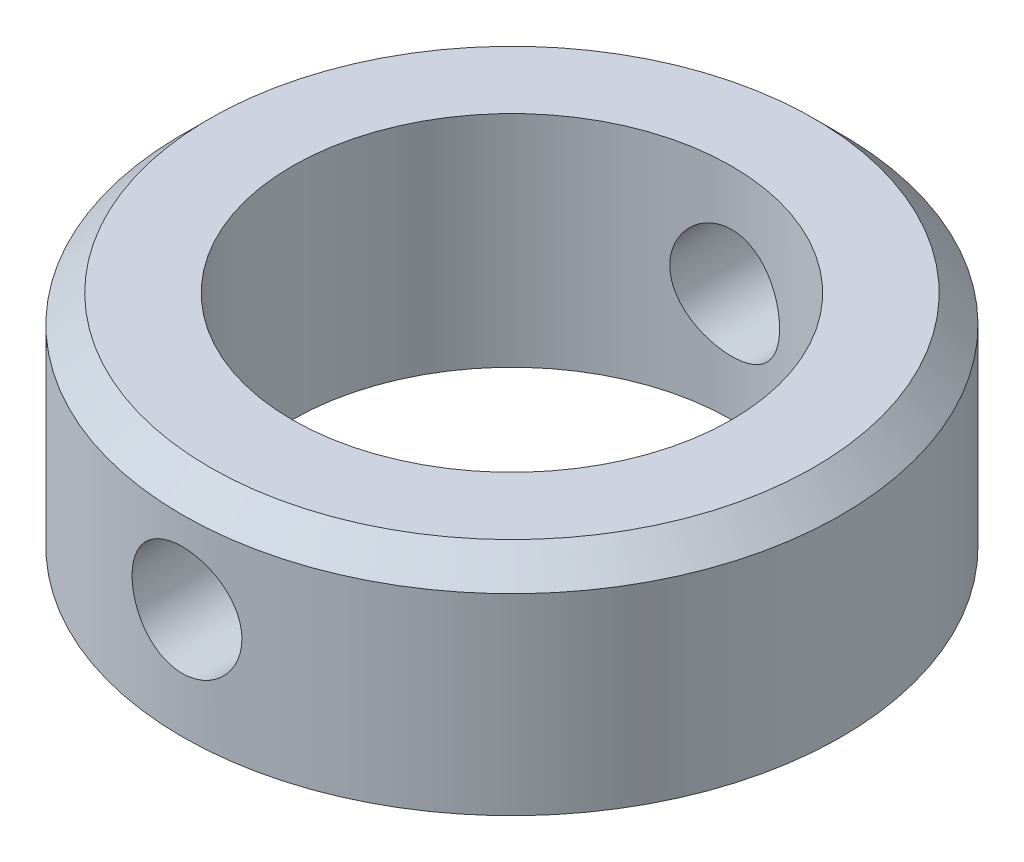
from build123d import *

# Parameters (mm, degrees)
SKETCH2_R               = 12
SKETCH2_R_2             = 8
BOSS_EXTRUDE1_DEPTH     = 8
CUT_EXTRUDE1_DEPTH      = 19.761663039
CUT_EXTRUDE1_DEPTH_BACK = 19.761663039
SKETCH3_R               = 2
CHAMFER1_SIZE           = 1


with BuildPart() as part:
    # Sketch2 → Boss-Extrude1 (new body)
    with BuildSketch(Plane(origin=(0, 0, 0), x_dir=(1, 0, 0), z_dir=(0, 1, 0))):
        with Locations(Location((0, 0, 0), (0, 0, 270))):
            Circle(SKETCH2_R)
        with Locations(Location((0, 0, 0), (0, 0, 270))):
            Circle(SKETCH2_R_2, mode=Mode.SUBTRACT)
    extrude(amount=BOSS_EXTRUDE1_DEPTH)

    # Sketch3 → Cut-Extrude1 (cut, two sides: drawn at the far end of the back side and taken through both)
    with BuildSketch(Plane.XY.offset(-CUT_EXTRUDE1_DEPTH_BACK)):
        with Locations((0, 4)):
            Circle(SKETCH3_R)
    extrude(amount=CUT_EXTRUDE1_DEPTH + CUT_EXTRUDE1_DEPTH_BACK, mode=Mode.SUBTRACT)

    # Chamfer1
    chamfer1_edges = [part.edges().sort_by_distance(p)[0] for p in [
        (0, 8, -12),
    ]]
    chamfer(chamfer1_edges, length=CHAMFER1_SIZE)


solid = part.part
